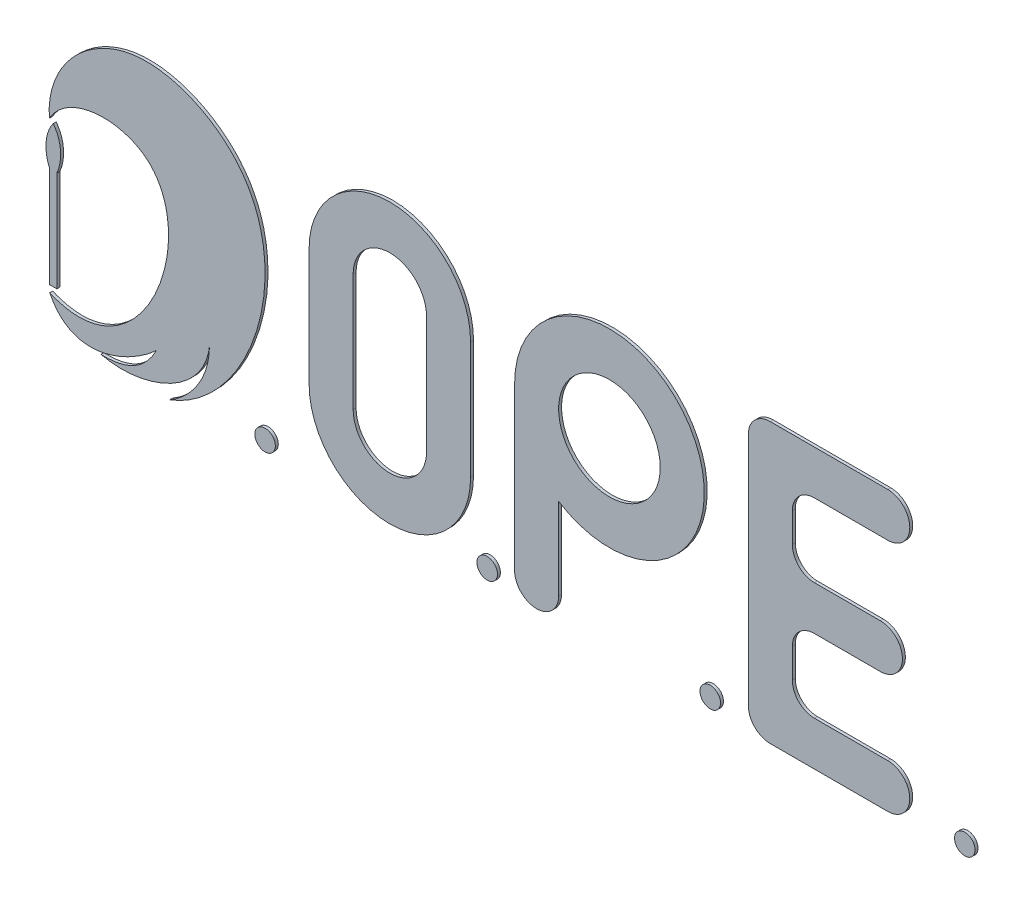
from build123d import *

# Parameters (mm, degrees)
BOSS_EXTRUDE2_DEPTH   = 1
BOSS_EXTRUDE2_2_DEPTH = 1
SKETCH1_R             = 17.306246178
BOSS_EXTRUDE2_3_DEPTH = 1
BOSS_EXTRUDE2_4_DEPTH = 1
SKETCH1_R_2           = 3.5
BOSS_EXTRUDE2_5_DEPTH = 1
BOSS_EXTRUDE2_6_DEPTH = 1
BOSS_EXTRUDE2_7_DEPTH = 1
BOSS_EXTRUDE2_8_DEPTH = 1
BOSS_EXTRUDE2_9_DEPTH = 1


with BuildPart() as part:
    # Sketch1 → Boss-Extrude2 (new body)
    with BuildSketch(Plane.XY):
        with BuildLine():
            add(Edge.make_bspline(
                [(4.176977783, -42.078185234), (18.395083622, -45.682524488), (39.336025743, -37.451807212), (41.128331273, -21.205264171)],
                knots=[0, 0, 0, 0, 1, 1, 1, 1], degree=3))
            add(Edge.make_bspline(
                [(41.128331273, -21.205264171), (41.208901802, -30.388911485), (35.516667738, -39.241031169), (27.607041209, -43.768658793)],
                knots=[0, 0, 0, 0, 1, 1, 1, 1], degree=3))
            add(Edge.make_bspline(
                [(-13.399125446, 18.761712123), (-14.595958135, 34.786255378), (10.553904842, 61.655876776), (77.770432351, 31.919386813), (54.935467618, -33.501084615), (27.607041209, -43.768658793)],
                knots=[0, 0, 0, 0, 0.258384755, 0.488789274, 1, 1, 1, 1], degree=3))
            add(Edge.make_bspline(
                [(-13.399125446, 18.761712123), (-7.123250575, 29.873286707), (48.621576352, 32.824960108), (18.52393849, -46.184621535), (-13.267373889, -32.633459969)],
                knots=[0, 0, 0, 0, 0.318657049, 1, 1, 1, 1], degree=3))
            add(Edge.make_bspline(
                [(-13.267373889, -32.633459969), (-5.380803499, -48.687362539), (13.798541794, -40.167801005), (23.104333777, -31.440277806)],
                knots=[0, 0, 0, 0, 1, 1, 1, 1], degree=3))
            add(Edge.make_bspline(
                [(23.104333777, -31.440277806), (17.42523783, -42.64360628), (4.176977783, -42.078185234)],
                knots=[0, 0, 0, 1, 1, 1], degree=2))
        make_face()
    extrude(amount=BOSS_EXTRUDE2_DEPTH)


with BuildPart() as body_2:
    # Sketch1 → Boss-Extrude2 2 (new body)
    with BuildSketch(Plane.XY):
        with BuildLine():
            Line((75.09173282, 24.58453691), (75.09173282, -15.41546309))
            ThreePointArc((75.09173282, -15.41546309), (102.59173282, -42.91546309), (130.09173282, -15.41546309))
            Line((130.09173282, -15.41546309), (130.09173282, 24.58453691))
            ThreePointArc((130.09173282, 24.58453691), (102.59173282, 52.08453691), (75.09173282, 24.58453691))
        make_face()
        with BuildLine():
            ThreePointArc((90.09173282, -15.41546309), (102.59173282, -27.91546309), (115.09173282, -15.41546309))
            Line((115.09173282, -15.41546309), (115.09173282, 24.58453691))
            ThreePointArc((115.09173282, 24.58453691), (102.59173282, 37.08453691), (90.09173282, 24.58453691))
            Line((90.09173282, 24.58453691), (90.09173282, -15.41546309))
        make_face(mode=Mode.SUBTRACT)
    extrude(amount=BOSS_EXTRUDE2_2_DEPTH)


with BuildPart() as body_3:
    # Sketch1 → Boss-Extrude2 3 (new body)
    with BuildSketch(Plane.XY):
        with BuildLine():
            ThreePointArc((160.09173282, -35.41546309), (152.59173282, -42.91546309), (145.09173282, -35.41546309))
            Line((145.09173282, -35.41546309), (145.09173282, 19.778290732))
            ThreePointArc((145.09173282, 19.778290732), (205.706929805, 35.344177997), (160.09173282, -7.501507385))
            Line((160.09173282, -7.501507385), (160.09173282, -35.41546309))
        make_face()
        with Locations((177.397978998, 19.778290732)):
            Circle(SKETCH1_R, mode=Mode.SUBTRACT)
    extrude(amount=BOSS_EXTRUDE2_3_DEPTH)


with BuildPart() as body_4:
    # Sketch1 → Boss-Extrude2 4 (new body)
    with BuildSketch(Plane.XY):
        with BuildLine():
            ThreePointArc((239.704225176, 19.58453691), (241.900924317, 14.281236051), (247.204225176, 12.08453691))
            Line((247.204225176, 12.08453691), (269.704225176, 12.08453691))
            ThreePointArc((269.704225176, 12.08453691), (277.204225176, 4.58453691), (269.704225176, -2.91546309))
            Line((269.704225176, -2.91546309), (247.204225176, -2.91546309))
            ThreePointArc((247.204225176, -2.91546309), (241.900924317, -5.112162231), (239.704225176, -10.41546309))
            Line((239.704225176, -10.41546309), (239.704225176, -20.41546309))
            ThreePointArc((239.704225176, -20.41546309), (241.900924317, -25.718763949), (247.204225176, -27.91546309))
            Line((247.204225176, -27.91546309), (272.204225176, -27.91546309))
            ThreePointArc((272.204225176, -27.91546309), (279.704225176, -35.41546309), (272.204225176, -42.91546309))
            Line((272.204225176, -42.91546309), (232.204225176, -42.91546309))
            ThreePointArc((232.204225176, -42.91546309), (226.900924317, -40.718763949), (224.704225176, -35.41546309))
            Line((224.704225176, -35.41546309), (224.704225176, 44.58453691))
            ThreePointArc((224.704225176, 44.58453691), (226.900924317, 49.887837769), (232.204225176, 52.08453691))
            Line((232.204225176, 52.08453691), (272.204225176, 52.08453691))
            ThreePointArc((272.204225176, 52.08453691), (279.704225176, 44.58453691), (272.204225176, 37.08453691))
            Line((272.204225176, 37.08453691), (247.204225176, 37.08453691))
            ThreePointArc((247.204225176, 37.08453691), (241.900924317, 34.887837769), (239.704225176, 29.58453691))
            Line((239.704225176, 29.58453691), (239.704225176, 19.58453691))
        make_face()
    extrude(amount=BOSS_EXTRUDE2_4_DEPTH)


with BuildPart() as body_5:
    # Sketch1 → Boss-Extrude2 5 (new body)
    with BuildSketch(Plane.XY):
        with Locations((60.09173282, -39.41546309)):
            Circle(SKETCH1_R_2)
    extrude(amount=BOSS_EXTRUDE2_5_DEPTH)


with BuildPart() as body_6:
    # Sketch1 → Boss-Extrude2 6 (new body)
    with BuildSketch(Plane.XY):
        with Locations((211.739881598, -39.41546309)):
            Circle(SKETCH1_R_2)
    extrude(amount=BOSS_EXTRUDE2_6_DEPTH)


with BuildPart() as body_7:
    # Sketch1 → Boss-Extrude2 7 (new body)
    with BuildSketch(Plane.XY):
        with Locations((298.448680124, -39.41546309)):
            Circle(SKETCH1_R_2)
    extrude(amount=BOSS_EXTRUDE2_7_DEPTH)


with BuildPart() as body_8:
    # Sketch1 → Boss-Extrude2 8 (new body)
    with BuildSketch(Plane.XY):
        with Locations((135.756758441, -39.41546309)):
            Circle(SKETCH1_R_2)
    extrude(amount=BOSS_EXTRUDE2_8_DEPTH)


with BuildPart() as body_9:
    # Sketch1 → Boss-Extrude2 9 (new body)
    with BuildSketch(Plane.XY):
        with BuildLine():
            Line((-10.839438068, -30.279571053), (-10.839438068, 3.862337))
            add(Edge.make_bspline(
                [(-10.839438068, 3.862337), (-8.857628869, 8.32956724), (-9.066883985, 13.910194283), (-12.053405979, 17.888605243)],
                knots=[0, 0, 0, 0, 1, 1, 1, 1], degree=3))
            add(Edge.make_bspline(
                [(-13.267373889, 3.862337), (-15.249183089, 8.32956724), (-15.039927972, 13.910194283), (-12.053405979, 17.888605243)],
                knots=[0, 0, 0, 0, 1, 1, 1, 1], degree=3))
            Line((-13.267373889, 3.862337), (-13.267373889, -30.279571053))
            Line((-13.267373889, -30.279571053), (-10.839438068, -30.279571053))
        make_face()
    extrude(amount=BOSS_EXTRUDE2_9_DEPTH)


solid = Compound([part.part, body_2.part, body_3.part, body_4.part, body_5.part, body_6.part, body_7.part, body_8.part, body_9.part])
